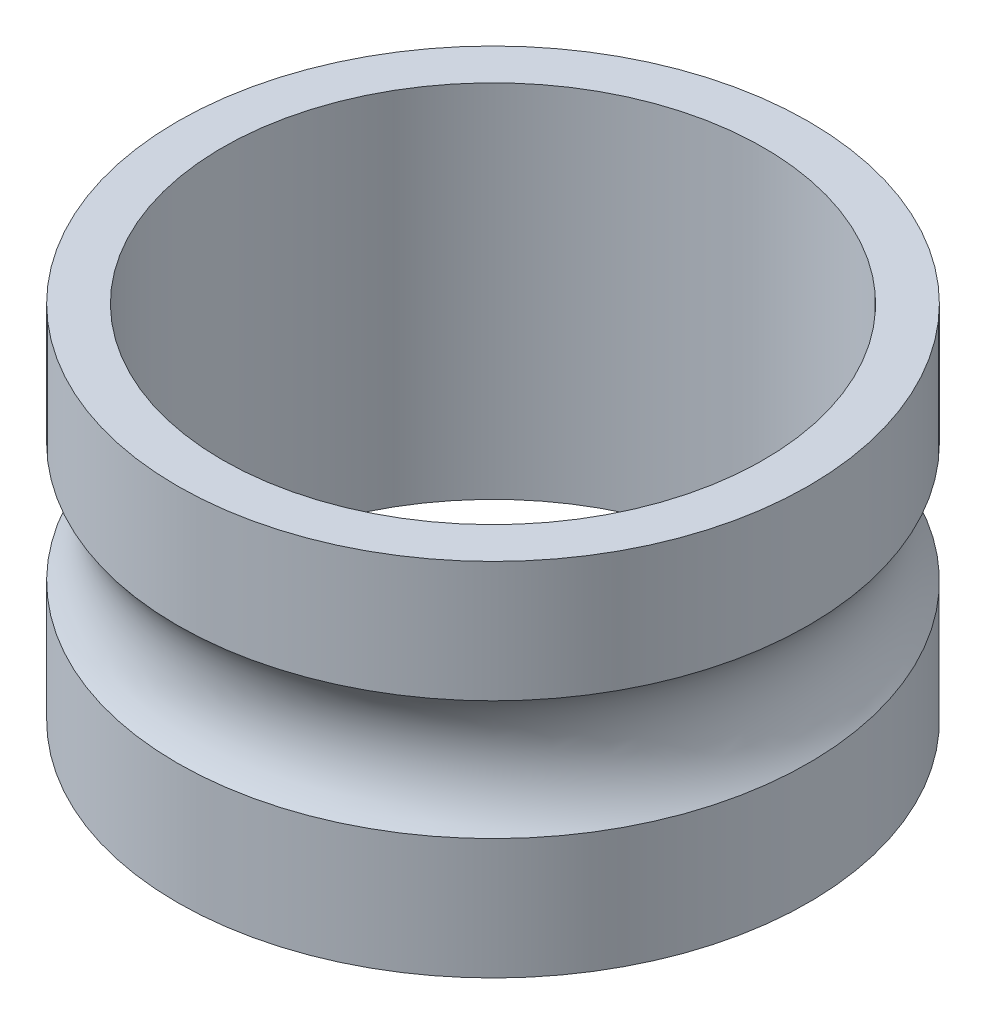
from build123d import *

# Parameters (mm, degrees)
DIAPROFILES_R         = 1.75
DIAPROFILES_R_2       = 1.5
DIAPROFILE_DEPTH      = 1
BEARINGPATHPROFILES_R = 0.5


with BuildPart() as part:
    # DiaProfileS → DiaProfile (new, symmetric)
    with BuildSketch(Plane(origin=(0, 0, 0), x_dir=(1, 0, 0), z_dir=(0, 1, 0))):
        with Locations(Location((0, 0, 0), (0, 0, 270))):
            Circle(DIAPROFILES_R)
        with Locations(Location((0, 0, 0), (0, 0, 270))):
            Circle(DIAPROFILES_R_2, mode=Mode.SUBTRACT)
    extrude(amount=DIAPROFILE_DEPTH, both=True)

    # BearingPathProfileS → BearingPathProfile (revolve, cut)
    with BuildSketch(Plane.XY, mode=Mode.PRIVATE) as bearingpathprofile_sk:
        with Locations((2.125, 0)):
            Circle(BEARINGPATHPROFILES_R)
    revolve(bearingpathprofile_sk.sketch.rotate(Axis((0, 1, 0), (0, -1, 0)), 90), axis=Axis((0, 1, 0), (0, -1, 0)), mode=Mode.SUBTRACT)


solid = part.part
